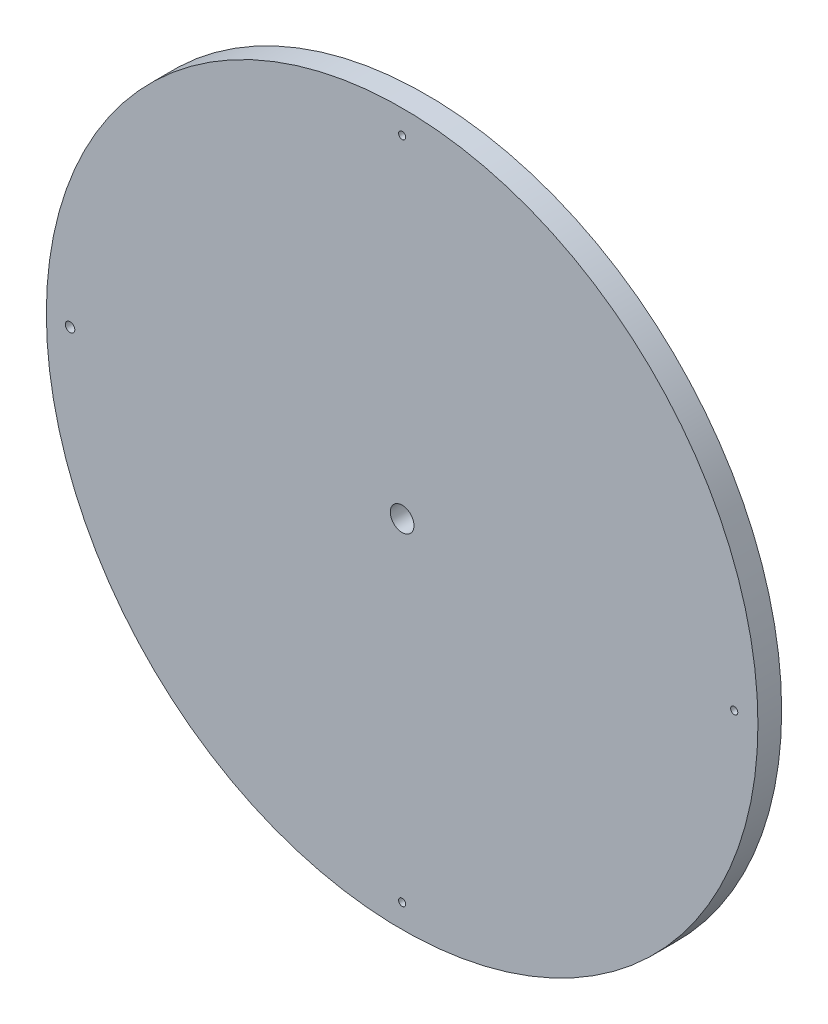
from build123d import *

# Parameters (mm, degrees)
SKETCH1_R           = 150
BOSS_EXTRUDE1_DEPTH = 10
SKETCH3_R           = 1.5
CUT_EXTRUDE1_DEPTH  = 10
SKETCH5_R           = 1.5
SKETCH5_R_2         = 2
CUT_EXTRUDE2_DEPTH  = 10
SKETCH6_R           = 5
CUT_EXTRUDE8_DEPTH  = 10


with BuildPart() as part:
    # Sketch1 → Boss-Extrude1 (new body)
    with BuildSketch(Plane.XY):
        Circle(SKETCH1_R)
    extrude(amount=BOSS_EXTRUDE1_DEPTH)

    # Sketch3 → Cut-Extrude1 (cut)
    with BuildSketch(Plane.XY.offset(10)):
        with Locations((0, 140)):
            Circle(SKETCH3_R)
    extrude(amount=-CUT_EXTRUDE1_DEPTH, mode=Mode.SUBTRACT)

    # Sketch5 → Cut-Extrude2 (cut)
    with BuildSketch(Plane.XY.offset(10)):
        with Locations((0, -140)):
            Circle(SKETCH5_R)
        with Locations((-140, 0)):
            Circle(SKETCH5_R_2)
        with Locations((140, 0)):
            Circle(SKETCH5_R)
    extrude(amount=-CUT_EXTRUDE2_DEPTH, mode=Mode.SUBTRACT)

    # Sketch6 → Cut-Extrude8 (cut)
    with BuildSketch(Plane.XY.offset(10)):
        Circle(SKETCH6_R)
    extrude(amount=-CUT_EXTRUDE8_DEPTH, mode=Mode.SUBTRACT)


solid = part.part
